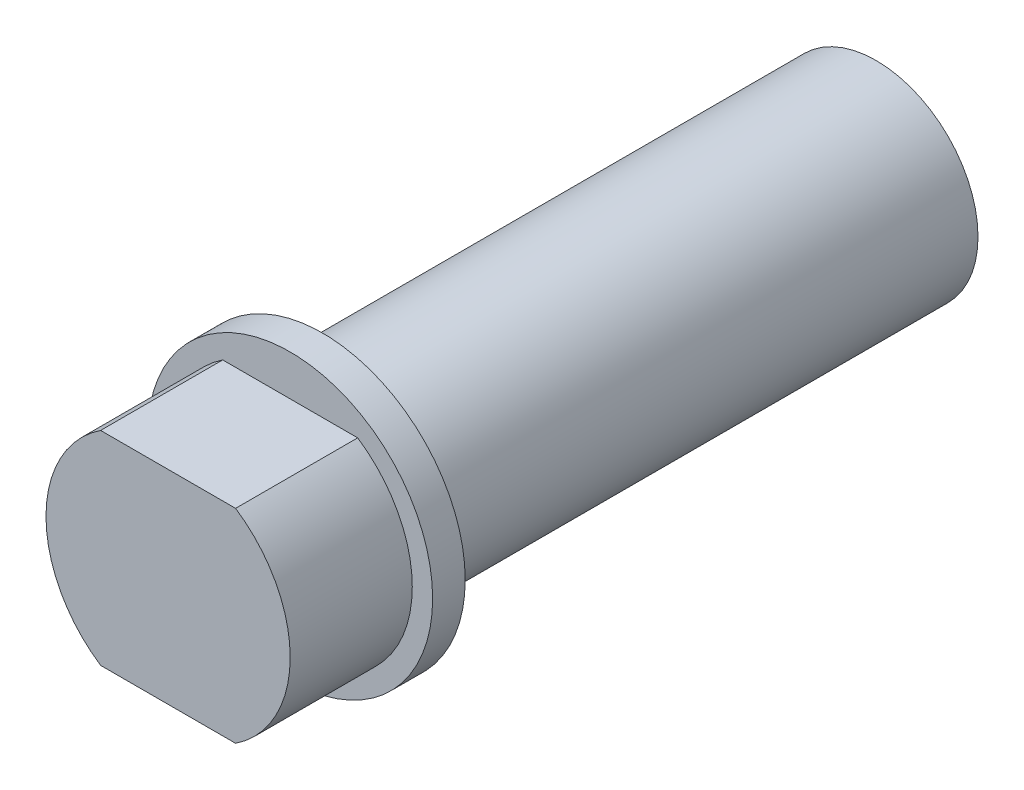
from build123d import *

# Parameters (mm, degrees)
SKETCH1_R                  = 12.5
SHAFT_D25X68_DEPTH         = 68
SKETCH2_R                  = 17.5
COLLAR_D35X4_DEPTH         = 4
SKETCH3_R                  = 15
GEARD_SEAT_D30X15_DEPTH    = 15
SKETCH4_W                  = 32
SKETCH4_H                  = 3.5
DOUBLE_FLAT_CUT_25MM_DEPTH = 15
SKETCH5_W                  = 1
SKETCH5_H                  = 2


with BuildPart() as part:
    # Sketch1 → Shaft_D25x68 (new body)
    with BuildSketch(Plane.XY):
        Circle(SKETCH1_R)
    extrude(amount=SHAFT_D25X68_DEPTH)

    # Sketch2 → Collar_D35x4 (add)
    with BuildSketch(Plane.XY.offset(68)):
        Circle(SKETCH2_R)
    extrude(amount=COLLAR_D35X4_DEPTH)

    # Sketch3 → GearD_Seat_D30x15 (add)
    with BuildSketch(Plane.XY.offset(72)):
        Circle(SKETCH3_R)
    extrude(amount=GEARD_SEAT_D30X15_DEPTH)

    # Sketch4 → Double_Flat_Cut_25mm (cut)
    with BuildSketch(Plane.XY.offset(72)):
        with Locations((0, 14.25)):
            Rectangle(SKETCH4_W, SKETCH4_H)
        with Locations((0, -14.25)):
            Rectangle(SKETCH4_W, SKETCH4_H)
    extrude(amount=DOUBLE_FLAT_CUT_25MM_DEPTH, mode=Mode.SUBTRACT)

    # Sketch5 → SnapRing_Groove_D23x1 (revolve, cut)
    with BuildSketch(Plane(origin=(0, 0, 0), x_dir=(0, 0, -1), z_dir=(1, 0, 0)), mode=Mode.PRIVATE) as snapring_groove_d23x1_sk:
        with Locations((-65.5, 12.5)):
            Rectangle(SKETCH5_W, SKETCH5_H)
    revolve(snapring_groove_d23x1_sk.sketch.rotate(Axis((0, 0, 90), (0, 0, -1)), 90), axis=Axis((0, 0, 90), (0, 0, -1)), mode=Mode.SUBTRACT)


solid = part.part
